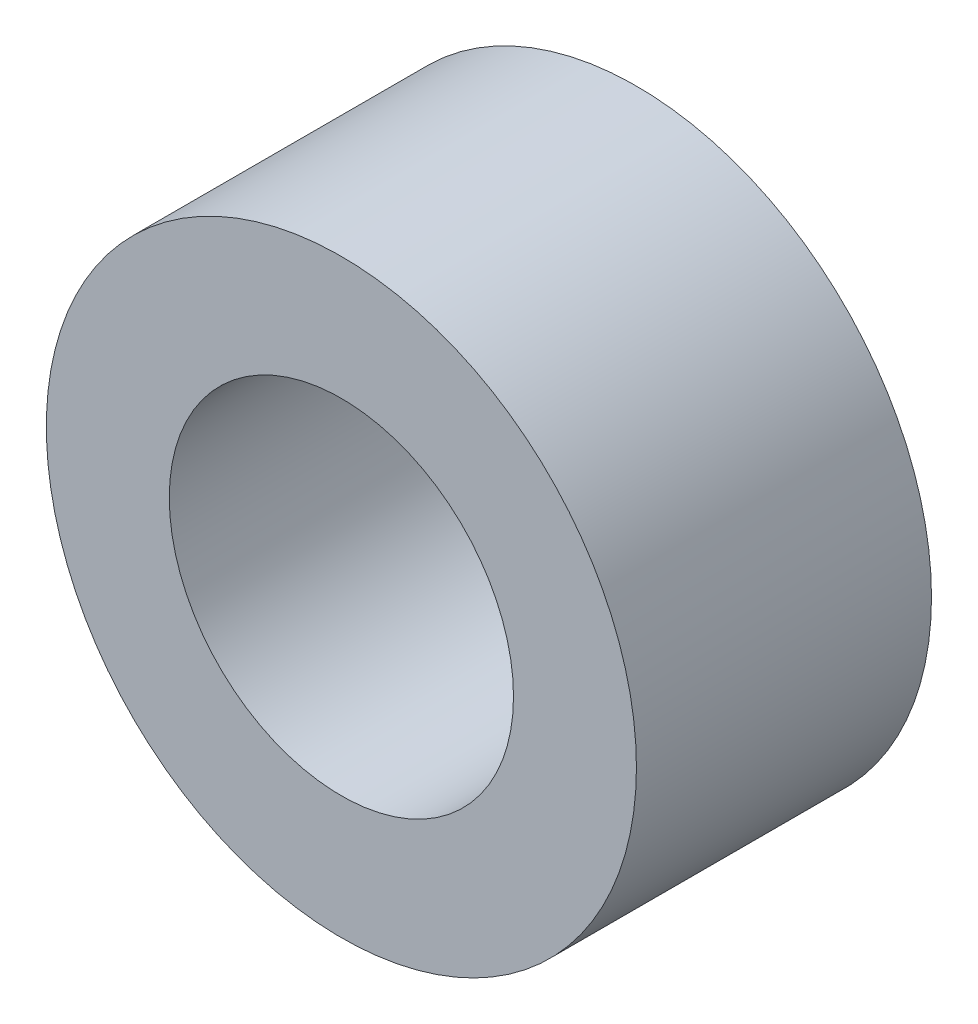
from build123d import *

# Parameters (mm, degrees)
SKETCH1_R           = 3
SKETCH1_R_2         = 1.75
BOSS_EXTRUDE1_DEPTH = 3


with BuildPart() as part:
    # Sketch1 → Boss-Extrude1 (new body)
    with BuildSketch(Plane.XY):
        Circle(SKETCH1_R)
        Circle(SKETCH1_R_2, mode=Mode.SUBTRACT)
    extrude(amount=BOSS_EXTRUDE1_DEPTH)


solid = part.part
